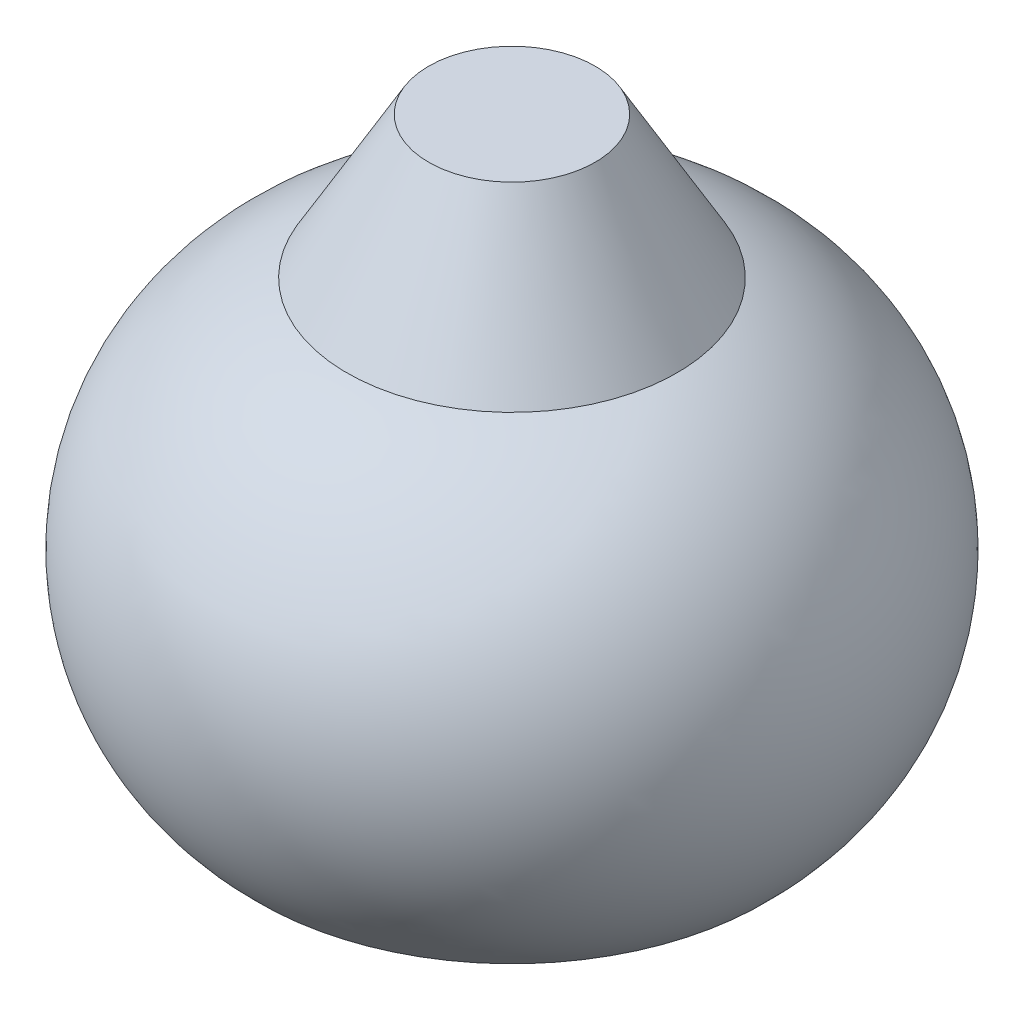
from build123d import *


with BuildPart() as part:
    # 草图7 → 旋转5 (revolve)
    with BuildSketch(Plane.XY):
        with BuildLine():
            Line((0, 23.219710091), (0, -23.219710091))
            Line((0, -23.219710091), (-19.814954576, -23.219710091))
            Line((-19.814954576, -23.219710091), (-19.814954576, -46.780289909))
            Line((-19.814954576, -46.780289909), (-25, -46.780289909))
            Line((-25, -46.780289909), (-30.196152423, -43.780289909))
            ThreePointArc((-30.196152423, -43.780289909), (-38.958147203, -15.883397195), (-19.814954576, 6.219710091))
            Line((-19.814954576, 6.219710091), (-10, 23.219710091))
            Line((-10, 23.219710091), (0, 23.219710091))
        make_face()
    revolve(axis=Axis((0, 23.219710091, 0), (0, -1, 0)))


solid = part.part
